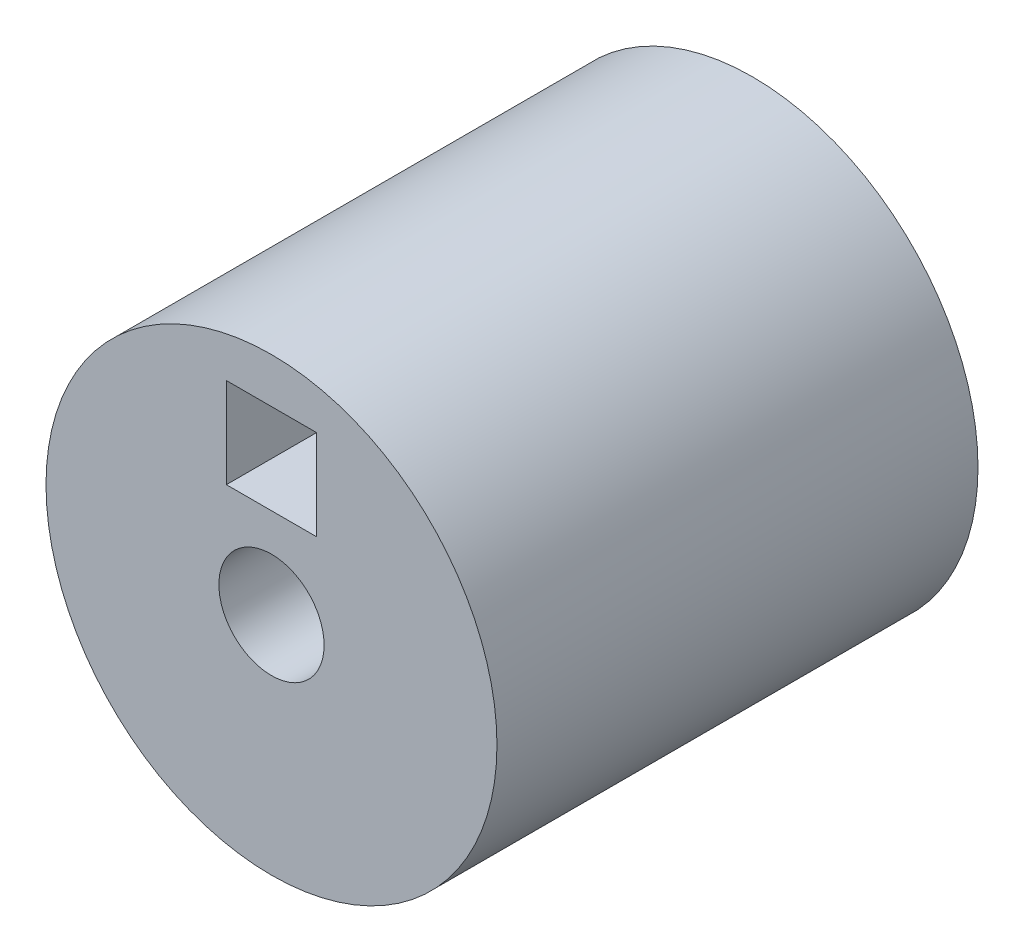
from build123d import *

# Parameters (mm, degrees)
SKETCH1_R           = 7.5
SKETCH1_R_2         = 1.75
BOSS_EXTRUDE1_DEPTH = 16
SKETCH2_W           = 3
SKETCH2_H           = 3
CUT_EXTRUDE1_DEPTH  = 8
CUT_EXTRUDE2_DEPTH  = 8


with BuildPart() as part:
    # Sketch1 → Boss-Extrude1 (new body)
    with BuildSketch(Plane.XY):
        Circle(SKETCH1_R)
        Circle(SKETCH1_R_2, mode=Mode.SUBTRACT)
    extrude(amount=BOSS_EXTRUDE1_DEPTH)

    # Sketch2 → Cut-Extrude1 (cut)
    with BuildSketch(Plane.XY.offset(16)):
        with Locations((0, 4.5)):
            Rectangle(SKETCH2_W, SKETCH2_H)
    extrude(amount=-CUT_EXTRUDE1_DEPTH, mode=Mode.SUBTRACT)

    # Sketch3 → Cut-Extrude2 (cut)
    with BuildSketch(Plane(origin=(0, 0, 0), x_dir=(-1, 0, 0), z_dir=(0, 0, -1))):
        Polygon((3.31669504, -0.499533791), (2.389644057, 2.353635758), (5.242813606, 3.280686741), (6.169864589, 0.427517192), align=None)
    extrude(amount=-CUT_EXTRUDE2_DEPTH, mode=Mode.SUBTRACT)


solid = part.part
